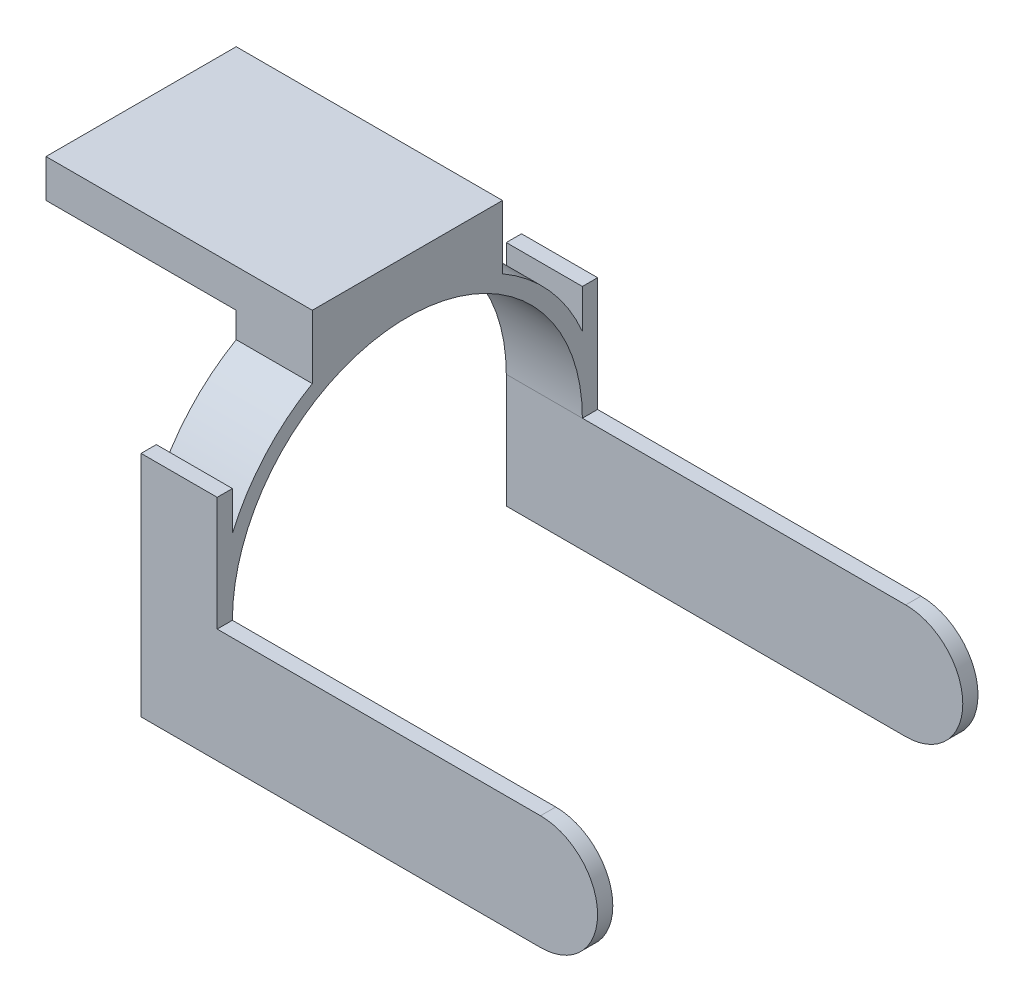
from build123d import *

# Parameters (mm, degrees)
EXTRUDE_1_DEPTH     = 20
SKETCH_2_W          = 4
SKETCH_2_H          = 30
EXTRUDE_2_DEPTH     = 100
CUT_EXTRUDE_1_DEPTH = 100
SKETCH_4_W          = 50
SKETCH_4_H          = 10
EXTRUDE_3_DEPTH     = 50


with BuildPart() as part:
    # 草图1 → 凸台-拉伸1 (new body)
    with BuildSketch(Plane(origin=(0, 0, 0), x_dir=(0, 0, -1), z_dir=(1, 0, 0))):
        with BuildLine():
            Line((-25, 5), (25, 5))
            Line((25, 5), (25, -5))
            Line((25, -5), (25, -11.698777218))
            ThreePointArc((25, -11.698777218), (37.410642162, -21.801835726), (46, -35.304382227))
            Line((46, -35.304382227), (46, -25.083062159))
            Line((46, -25.083062159), (50, -25.083062159))
            Line((50, -25.083062159), (50, -85.083062159))
            Line((50, -85.083062159), (46, -85.083062159))
            Line((46, -85.083062159), (46, -55.083062159))
            ThreePointArc((46, -55.083062159), (0, -9.083062159), (-46, -55.083062159))
            Line((-46, -55.083062159), (-46, -85.083062159))
            Line((-46, -85.083062159), (-50, -85.083062159))
            Line((-50, -85.083062159), (-50, -25.083062159))
            Line((-50, -25.083062159), (-46, -25.083062159))
            Line((-46, -25.083062159), (-46, -35.304382227))
            ThreePointArc((-46, -35.304382227), (-37.410642162, -21.801835726), (-25, -11.698777218))
            Line((-25, -11.698777218), (-25, -5))
            Line((-25, -5), (-25, 5))
        make_face()
    extrude(amount=EXTRUDE_1_DEPTH)

    # 草图2 → 凸台-拉伸2 (add)
    with BuildSketch(Plane(origin=(20, 0, 0), x_dir=(0, 0, -1), z_dir=(1, 0, 0))):
        with Locations((-48, -70.083062159)):
            Rectangle(SKETCH_2_W, SKETCH_2_H)
        with Locations((48, -70.083062159)):
            Rectangle(SKETCH_2_W, SKETCH_2_H)
    extrude(amount=EXTRUDE_2_DEPTH)

    # 草图3 → 切除-拉伸1 (cut)
    with BuildSketch(Plane.XY.offset(50)):
        with BuildLine():
            Line((105, -55.083062159), (132.360099234, -55.083062159))
            Line((132.360099234, -55.083062159), (132.360099234, -85.083062159))
            Line((132.360099234, -85.083062159), (105, -85.083062159))
            ThreePointArc((105, -85.083062159), (120, -70.083062159), (105, -55.083062159))
        make_face()
    extrude(amount=-CUT_EXTRUDE_1_DEPTH, mode=Mode.SUBTRACT)

    # 草图4 → 凸台-拉伸3 (add)
    with BuildSketch(Plane.ZY):
        Rectangle(SKETCH_4_W, SKETCH_4_H)
    extrude(amount=EXTRUDE_3_DEPTH)


solid = part.part
